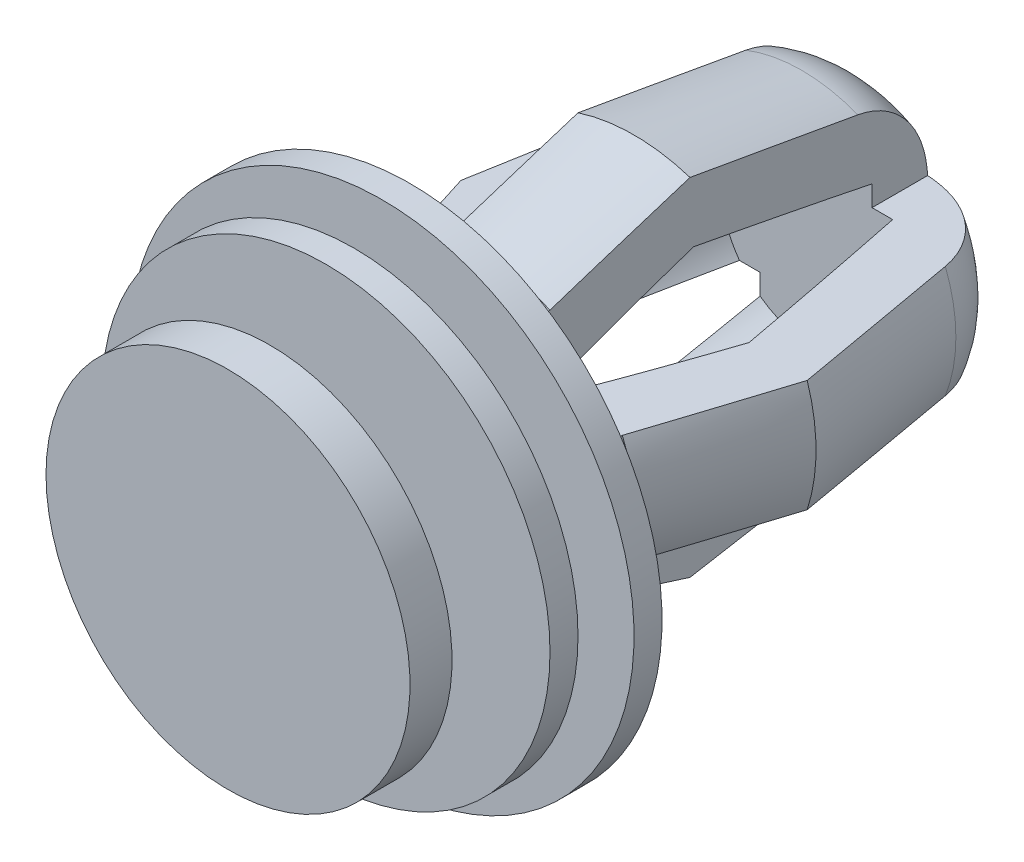
from build123d import *

# Parameters (mm, degrees)
FILLET_2_R               = 3
CUT_EXTRUDE_2_REACH      = 28.287
SKETCH_4_W               = 12.083655217
SKETCH_4_H               = 11.542596028
PATTERN_CIRCULAR_2_COUNT = 4


with BuildPart() as part:
    # ｽｹｯﾁ3 → 回転2 (revolve)
    with BuildSketch(Plane(origin=(0, 0, 0), x_dir=(0, 0, -1), z_dir=(1, 0, 0)), mode=Mode.PRIVATE) as revolve_2_sk:
        Polygon((-1.5, 5), (1.5, 5), (6.5, 6.5), (15, 5.083333333), (15, 0), (13, 0), (13, 3.389079157), (6.629586696, 4.450814707), (1.793537673, 3), (-1.5, 3), (-1.5, 0), (-8, 0), (-8, 6.5), (-6.5, 6.5), (-6.5, 3.5), (-4.5, 3.5), (-4.5, 8), (-3.5, 8), (-3.5, 3.5), (-2.5, 3.5), (-2.5, 9), (-1.5, 9), align=None)
    revolve(revolve_2_sk.sketch.rotate(Axis((0, 0, 0), (0, 0, 1)), 90), axis=Axis((0, 0, 0), (0, 0, 1)))

    # ﾌｨﾚｯﾄ2
    fillet_2_edges = [part.edges().sort_by_distance(p)[0] for p in [
        (5.083333333, 0, -15),
    ]]
    fillet(fillet_2_edges, radius=FILLET_2_R)

    # ｶｯﾄ - 押し出し2: up to this face of the body (flat: up to its plane)
    cut_extrude_2_end = Plane(part.part.faces().sort_by_distance((8.745441559, 0, 1.5))[0])
    # ｽｹｯﾁ4 → ｶｯﾄ - 押し出し2 (cut, up to the picked face)
    with BuildSketch(Plane(origin=(0, 0, -15), x_dir=(-1, 0, 0), z_dir=(0, 0, -1)), mode=Mode.PRIVATE) as cut_extrude_2_sk1:
        with Locations((-8.041827609, 7.771298014)):
            Rectangle(SKETCH_4_W, SKETCH_4_H)
    cut_extrude_2_tool1 = split(extrude(cut_extrude_2_sk1.sketch, amount=-CUT_EXTRUDE_2_REACH, mode=Mode.PRIVATE), bisect_by=cut_extrude_2_end, keep=Keep.BOTH, mode=Mode.PRIVATE)
    cut_extrude_2 = cut_extrude_2_tool1.solids().sort_by(Axis((8.041828, 7.771298, -15), (0, 0, 1)))[0]
    add(cut_extrude_2, mode=Mode.SUBTRACT)

    # 円形ﾊﾟﾀｰﾝ2: ｶｯﾄ - 押し出し2 ×4 about axis
    pattern_circular_2_axis = Axis((0, 0, 0), (0, 0, 1))
    for i in range(1, PATTERN_CIRCULAR_2_COUNT):
        add(cut_extrude_2.rotate(pattern_circular_2_axis, i * 360 / PATTERN_CIRCULAR_2_COUNT), mode=Mode.SUBTRACT)


solid = part.part
